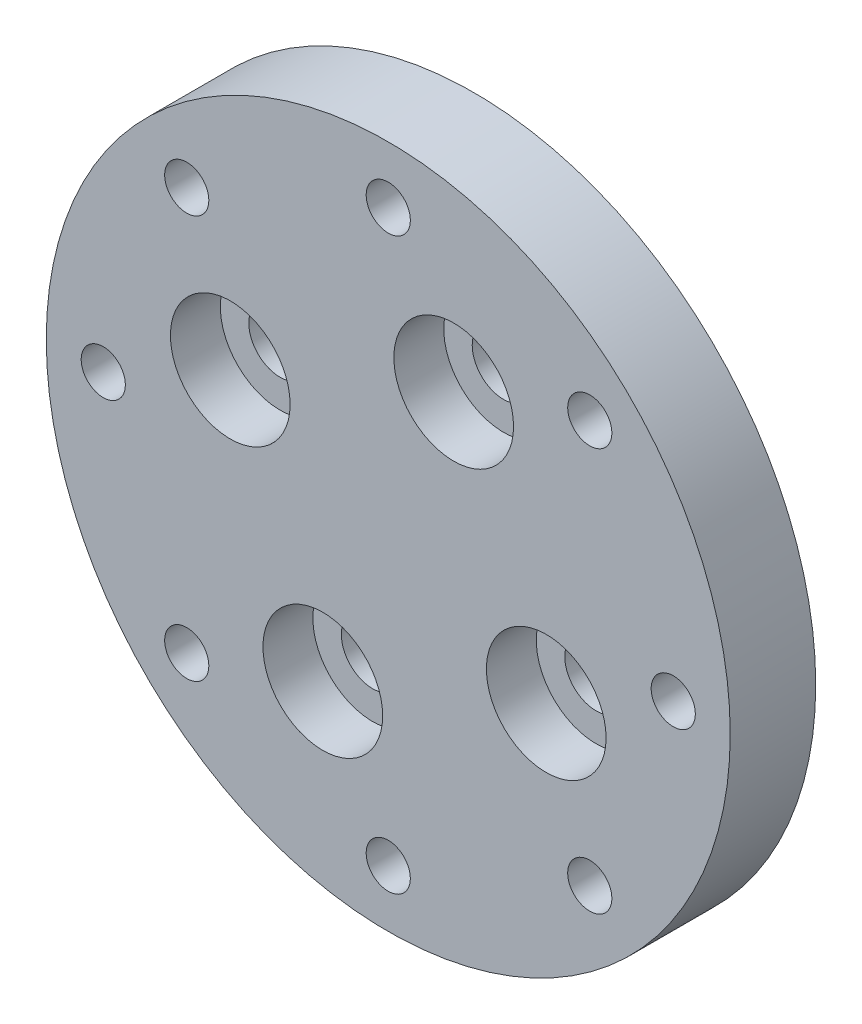
from build123d import *

# Parameters (mm, degrees)
SKETCH6_R           = 24
BOSS_EXTRUDE1_DEPTH = 6
SKETCH8_R           = 1.55
SKETCH8_R_2         = 2.2
CUT_EXTRUDE6_DEPTH  = 6
SKETCH11_R          = 4.2
CUT_EXTRUDE7_DEPTH  = 3.5
SKETCH12_R          = 3.5
CUT_EXTRUDE8_DEPTH  = 3


with BuildPart() as part:
    # Sketch6 → Boss-Extrude1 (new body)
    with BuildSketch(Plane.XY):
        Circle(SKETCH6_R)
    extrude(amount=BOSS_EXTRUDE1_DEPTH)

    # Sketch8 → Cut-Extrude6 (cut)
    with BuildSketch(Plane(origin=(0, 0, 0), x_dir=(-1, 0, 0), z_dir=(0, 0, -1))):
        with Locations((0, 20)):
            Circle(SKETCH8_R)
        with Locations((14.142135624, 14.142135624)):
            Circle(SKETCH8_R)
        with Locations((20, 0)):
            Circle(SKETCH8_R)
        with Locations((14.142135624, -14.142135624)):
            Circle(SKETCH8_R)
        with Locations((0, -20)):
            Circle(SKETCH8_R)
        with Locations((-14.142135624, -14.142135624)):
            Circle(SKETCH8_R)
        with Locations((-20, 0)):
            Circle(SKETCH8_R)
        with Locations((-14.142135624, 14.142135624)):
            Circle(SKETCH8_R)
        with Locations((11.08655439, 4.592201188)):
            Circle(SKETCH8_R_2)
        with Locations((4.592201188, -11.08655439)):
            Circle(SKETCH8_R_2)
        with Locations((-11.08655439, -4.592201188)):
            Circle(SKETCH8_R_2)
        with Locations((-4.592201188, 11.08655439)):
            Circle(SKETCH8_R_2)
    extrude(amount=-CUT_EXTRUDE6_DEPTH, mode=Mode.SUBTRACT)

    # Sketch11 → Cut-Extrude7 (cut)
    with BuildSketch(Plane.XY.offset(6)):
        with Locations((-11.08655439, 4.592201188)):
            Circle(SKETCH11_R)
        with Locations((4.592201188, 11.08655439)):
            Circle(SKETCH11_R)
        with Locations((11.08655439, -4.592201188)):
            Circle(SKETCH11_R)
        with Locations((-4.592201188, -11.08655439)):
            Circle(SKETCH11_R)
    extrude(amount=-CUT_EXTRUDE7_DEPTH, mode=Mode.SUBTRACT)

    # Sketch12 → Cut-Extrude8 (cut)
    with BuildSketch(Plane(origin=(0, 0, 0), x_dir=(-1, 0, 0), z_dir=(0, 0, -1))):
        with Locations((0, 20)):
            Circle(SKETCH12_R)
        with Locations((14.142135624, 14.142135624)):
            Circle(SKETCH12_R)
        with Locations((20, 0)):
            Circle(SKETCH12_R)
        with Locations((14.142135624, -14.142135624)):
            Circle(SKETCH12_R)
        with Locations((0, -20)):
            Circle(SKETCH12_R)
        with Locations((-14.142135624, -14.142135624)):
            Circle(SKETCH12_R)
        with Locations((-20, 0)):
            Circle(SKETCH12_R)
        with Locations((-14.142135624, 14.142135624)):
            Circle(SKETCH12_R)
    extrude(amount=-CUT_EXTRUDE8_DEPTH, mode=Mode.SUBTRACT)


solid = part.part
